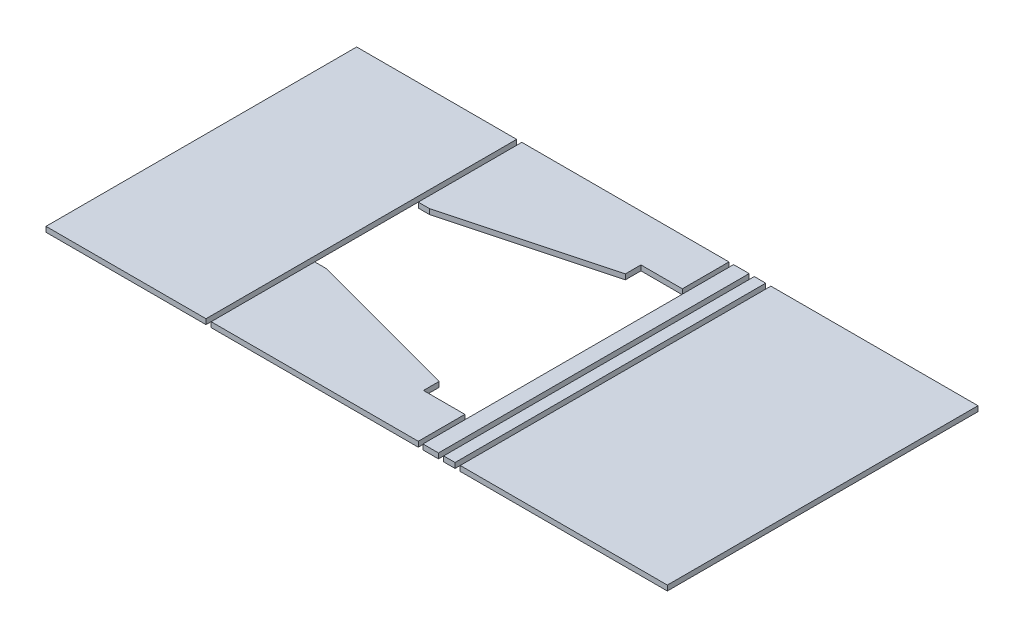
from build123d import *

# Parameters (mm, degrees)
SKETCH1_W             = 309
SKETCH1_H             = 600
BOSS_EXTRUDE1_DEPTH   = 10
BOSS_EXTRUDE1_2_DEPTH = 10
SKETCH1_W_2           = 400
BOSS_EXTRUDE1_3_DEPTH = 10
BOSS_EXTRUDE1_4_DEPTH = 10
SKETCH1_W_3           = 22
BOSS_EXTRUDE1_5_DEPTH = 10
SKETCH1_W_4           = 30
BOSS_EXTRUDE1_6_DEPTH = 10


with BuildPart() as part:
    # Sketch1 → Boss-Extrude1 (new body)
    with BuildSketch(Plane(origin=(0, 0, 0), x_dir=(1, 0, 0), z_dir=(0, 1, 0))):
        with Locations((154.5, 300)):
            Rectangle(SKETCH1_W, SKETCH1_H)
    extrude(amount=BOSS_EXTRUDE1_DEPTH)


with BuildPart() as body_2:
    # Sketch1 → Boss-Extrude1 2 (new body)
    with BuildSketch(Plane(origin=(0, 0, 0), x_dir=(1, 0, 0), z_dir=(0, 1, 0))):
        Polygon((719, 510), (719, 600), (319, 600), (319, 400), (340.435935394, 400), (639, 480), (639, 510), align=None)
    extrude(amount=BOSS_EXTRUDE1_2_DEPTH)


with BuildPart() as body_3:
    # Sketch1 → Boss-Extrude1 3 (new body)
    with BuildSketch(Plane(origin=(0, 0, 0), x_dir=(1, 0, 0), z_dir=(0, 1, 0))):
        with Locations((1000, 300)):
            Rectangle(SKETCH1_W_2, SKETCH1_H)
    extrude(amount=BOSS_EXTRUDE1_3_DEPTH)


with BuildPart() as body_4:
    # Sketch1 → Boss-Extrude1 4 (new body)
    with BuildSketch(Plane(origin=(0, 0, 0), x_dir=(1, 0, 0), z_dir=(0, 1, 0))):
        Polygon((719, 0), (719, 90), (639, 90), (639, 120), (340.435935394, 200), (319, 200), (319, 0), align=None)
    extrude(amount=BOSS_EXTRUDE1_4_DEPTH)


with BuildPart() as body_5:
    # Sketch1 → Boss-Extrude1 5 (new body)
    with BuildSketch(Plane(origin=(0, 0, 0), x_dir=(1, 0, 0), z_dir=(0, 1, 0))):
        with Locations((779, 300)):
            Rectangle(SKETCH1_W_3, SKETCH1_H)
    extrude(amount=BOSS_EXTRUDE1_5_DEPTH)


with BuildPart() as body_6:
    # Sketch1 → Boss-Extrude1 6 (new body)
    with BuildSketch(Plane(origin=(0, 0, 0), x_dir=(1, 0, 0), z_dir=(0, 1, 0))):
        with Locations((743, 300)):
            Rectangle(SKETCH1_W_4, SKETCH1_H)
    extrude(amount=BOSS_EXTRUDE1_6_DEPTH)


solid = Compound([part.part, body_2.part, body_3.part, body_4.part, body_5.part, body_6.part])
